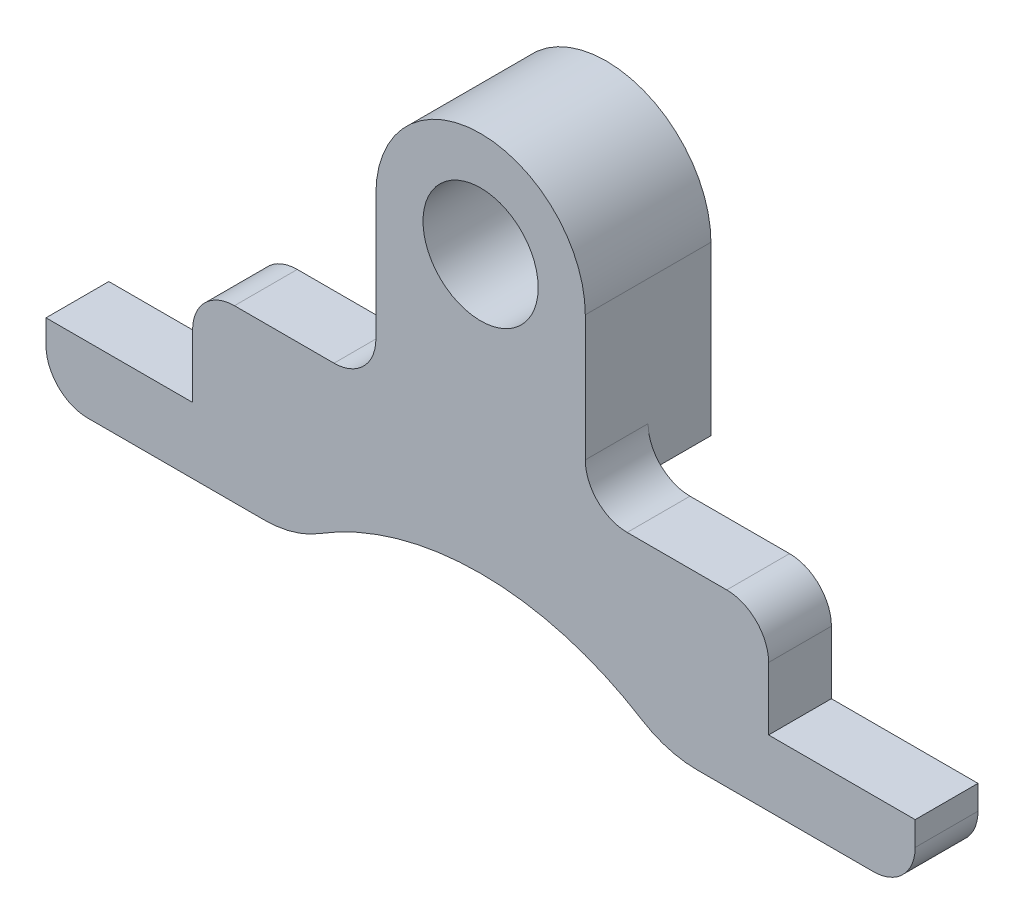
from build123d import *

# Parameters (mm, degrees)
SKETCH2_R           = 5
SKETCH2_R_2         = 2.75
BOSS_EXTRUDE1_DEPTH = 6
BOSS_EXTRUDE2_DEPTH = 3
FILLET1_R           = 2
FILLET2_R           = 5


with BuildPart() as part:
    # Sketch2 → Boss-Extrude1 (new body)
    # profile 1 of 2: a face of its own
    with BuildSketch(Plane.XY):
        with Locations((0, 27.75)):
            Circle(SKETCH2_R)
        with Locations((0, 27.75)):
            Circle(SKETCH2_R_2, mode=Mode.SUBTRACT)
    # profile 2 of 2: a face of its own
    with BuildSketch(Plane.XY):
        with BuildLine():
            ThreePointArc((5, 27.75), (0, 22.75), (-5, 27.75))
            Line((-5, 27.75), (-5, 19.75))
            Line((-5, 19.75), (5, 19.75))
            Line((5, 19.75), (5, 27.75))
        make_face()
    extrude(amount=BOSS_EXTRUDE1_DEPTH)

    # Sketch3 → Boss-Extrude2 (add)
    with BuildSketch(Plane.XY.offset(3)):
        with BuildLine():
            Line((5, 19.75), (-5, 19.75))
            Line((-5, 19.75), (-13.753194099, 19.75))
            Line((-13.753194099, 19.75), (-13.753194099, 14.75))
            Line((-13.753194099, 14.75), (-20.753194099, 14.75))
            Line((-20.753194099, 14.75), (-20.753194099, 11.59876127))
            Line((-20.753194099, 11.59876127), (-14.900453075, 11.59876127))
            Line((-14.900453075, 11.59876127), (-8.795188245, 11.59876127))
            ThreePointArc((-8.795188245, 11.59876127), (0, 14.556325061), (8.795188245, 11.59876127))
            Line((8.795188245, 11.59876127), (20.753194099, 11.59876127))
            Line((20.753194099, 11.59876127), (20.753194099, 14.75))
            Line((20.753194099, 14.75), (13.753194099, 14.75))
            Line((13.753194099, 14.75), (13.753194099, 19.75))
            Line((13.753194099, 19.75), (5, 19.75))
        make_face()
    extrude(amount=BOSS_EXTRUDE2_DEPTH)

    # Fillet1
    fillet1_edges = [part.edges().sort_by_distance(p)[0] for p in [
        (5, 19.75, 4.5),
        (-5, 19.75, 4.5),
        (-20.753194099, 11.59876127, 4.5),
        (20.753194099, 11.59876127, 4.5),
        (13.753194099, 19.75, 4.5),
        (-13.753194099, 19.75, 4.5),
    ]]
    fillet(fillet1_edges, radius=FILLET1_R)

    # Fillet2
    fillet2_edges = [part.edges().sort_by_distance(p)[0] for p in [
        (-8.795188245, 11.59876127, 4.5),
        (8.795188245, 11.59876127, 4.5),
    ]]
    fillet(fillet2_edges, radius=FILLET2_R)


solid = part.part
